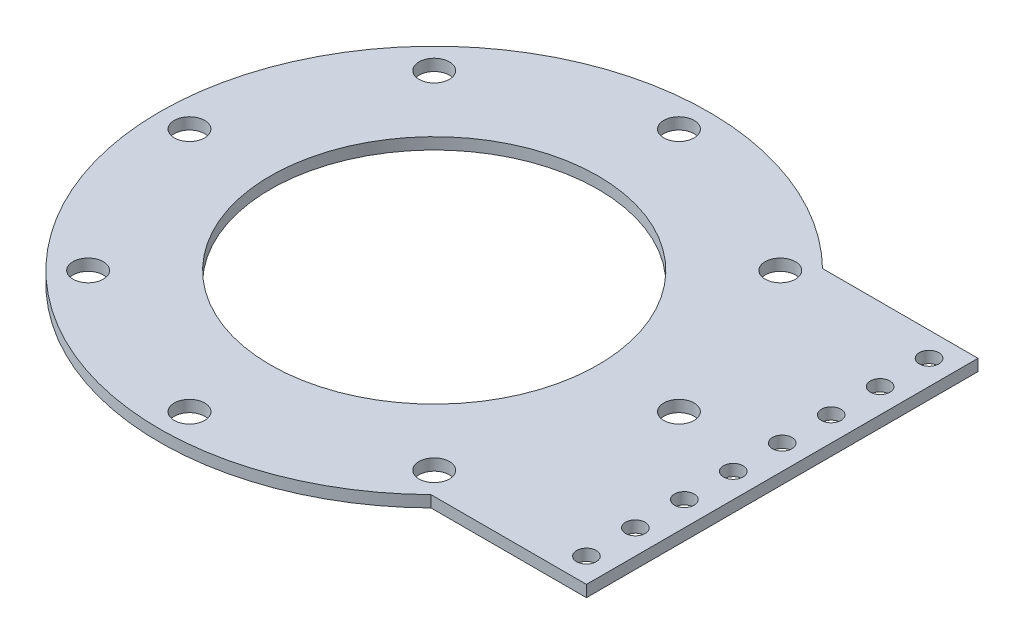
from build123d import *

# Parameters (mm, degrees)
SKETCH1_R           = 0.7874
SKETCH1_R_2         = 8.5
SKETCH1_R_3         = 0.508
BOSS_EXTRUDE1_DEPTH = 0.6


with BuildPart() as part:
    # Sketch1 → Boss-Extrude1 (new body)
    # profile 1 of 3: a face of its own
    with BuildSketch(Plane(origin=(0, 0, 0), x_dir=(1, 0, 0), z_dir=(0, 1, 0))):
        with BuildLine():
            Line((9.991841672, -10.16), (9.991841672, 10.16))
            ThreePointArc((9.991841672, 10.16), (-14.25, 0), (9.991841672, -10.16))
        make_face()
        with Locations(Location((-8.980256121, -8.980256121, 0), (0, 0, 270))):
            Circle(SKETCH1_R, mode=Mode.SUBTRACT)
        with Locations(Location((0, -12.7, 0), (0, 0, 270))):
            Circle(SKETCH1_R, mode=Mode.SUBTRACT)
        with Locations(Location((8.980256121, -8.980256121, 0), (0, 0, 270))):
            Circle(SKETCH1_R, mode=Mode.SUBTRACT)
        with Locations(Location((-12.7, 0, 0), (0, 0, 270))):
            Circle(SKETCH1_R, mode=Mode.SUBTRACT)
        with Locations(Location((0, 0, 0), (0, 0, 270))):
            Circle(SKETCH1_R_2, mode=Mode.SUBTRACT)
        with Locations(Location((-8.980256121, 8.980256121, 0), (0, 0, 270))):
            Circle(SKETCH1_R, mode=Mode.SUBTRACT)
        with Locations(Location((0, 12.7, 0), (0, 0, 270))):
            Circle(SKETCH1_R, mode=Mode.SUBTRACT)
        with Locations(Location((8.980256121, 8.980256121, 0), (0, 0, 270))):
            Circle(SKETCH1_R, mode=Mode.SUBTRACT)
    # profile 2 of 3: a face of its own
    with BuildSketch(Plane(origin=(0, 0, 0), x_dir=(1, 0, 0), z_dir=(0, 1, 0))):
        with BuildLine():
            ThreePointArc((14.25, 0), (13.142416898, 5.508119288), (9.991841672, 10.16))
            Line((9.991841672, 10.16), (9.991841672, -10.16))
            ThreePointArc((9.991841672, -10.16), (13.142416898, -5.508119288), (14.25, 0))
        make_face()
        with Locations(Location((12.7, 0, 0), (0, 0, 270))):
            Circle(SKETCH1_R, mode=Mode.SUBTRACT)
    # profile 3 of 3: a face of its own
    with BuildSketch(Plane(origin=(0, 0, 0), x_dir=(1, 0, 0), z_dir=(0, 1, 0))):
        with BuildLine():
            Line((18.06, 10.16), (9.991841672, 10.16))
            ThreePointArc((9.991841672, 10.16), (13.142416898, 5.508119288), (14.25, 0))
            ThreePointArc((14.25, 0), (13.142416898, -5.508119288), (9.991841672, -10.16))
            Line((9.991841672, -10.16), (18.06, -10.16))
            Line((18.06, -10.16), (18.06, 10.16))
        make_face()
        with Locations(Location((16.79, -8.89, 0), (0, 0, 270))):
            Circle(SKETCH1_R_3, mode=Mode.SUBTRACT)
        with Locations(Location((16.79, -6.35, 0), (0, 0, 270))):
            Circle(SKETCH1_R_3, mode=Mode.SUBTRACT)
        with Locations(Location((16.79, -3.81, 0), (0, 0, 270))):
            Circle(SKETCH1_R_3, mode=Mode.SUBTRACT)
        with Locations(Location((16.79, -1.27, 0), (0, 0, 270))):
            Circle(SKETCH1_R_3, mode=Mode.SUBTRACT)
        with Locations(Location((16.79, 1.27, 0), (0, 0, 270))):
            Circle(SKETCH1_R_3, mode=Mode.SUBTRACT)
        with Locations(Location((16.79, 3.81, 0), (0, 0, 270))):
            Circle(SKETCH1_R_3, mode=Mode.SUBTRACT)
        with Locations(Location((16.79, 6.35, 0), (0, 0, 270))):
            Circle(SKETCH1_R_3, mode=Mode.SUBTRACT)
        with Locations(Location((16.79, 8.89, 0), (0, 0, 270))):
            Circle(SKETCH1_R_3, mode=Mode.SUBTRACT)
    extrude(amount=BOSS_EXTRUDE1_DEPTH)


solid = part.part
